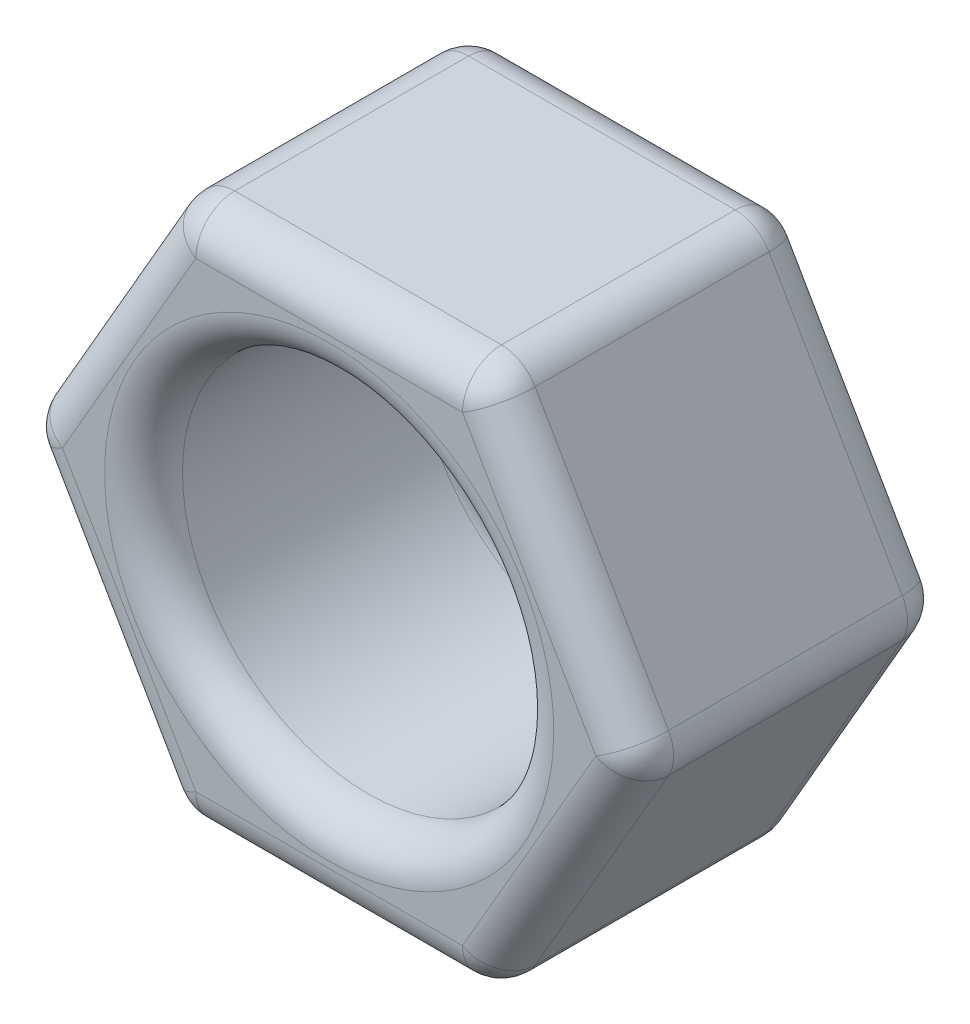
from build123d import *

# Parameters (mm, degrees)
ESBO_O1_R                = 4.765
RESSALTO_EXTRUS_O1_DEPTH = 8
FILETE1_R                = 1


with BuildPart() as part:
    # Esboço1 → Ressalto-extrusão1 (new body)
    with BuildSketch(Plane.XY):
        Polygon((8, 0), (4, 6.92820323), (-4, 6.92820323), (-8, 0), (-4, -6.92820323), (4, -6.92820323), align=None)
        Circle(ESBO_O1_R, mode=Mode.SUBTRACT)
    extrude(amount=RESSALTO_EXTRUS_O1_DEPTH)

    # Filete1
    filete1_edges = [part.edges().sort_by_distance(p)[0] for p in [
        (0, 6.92820323, 8),
        (4, -6.92820323, 4),
        (-4, -6.92820323, 4),
        (-8, 0, 4),
        (-4, 6.92820323, 4),
        (4, 6.92820323, 4),
        (8, 0, 4),
        (-6, 3.464101615, 8),
        (-6, -3.464101615, 8),
        (-4.765, 0, 0),
        (-4.765, 0, 8),
        (0, -6.92820323, 8),
        (6, -3.464101615, 8),
        (0, -6.92820323, 0),
        (-6, -3.464101615, 0),
        (-6, 3.464101615, 0),
        (6, 3.464101615, 8),
        (0, 6.92820323, 0),
        (6, 3.464101615, 0),
        (6, -3.464101615, 0),
    ]]
    fillet(filete1_edges, radius=FILETE1_R)


solid = part.part
